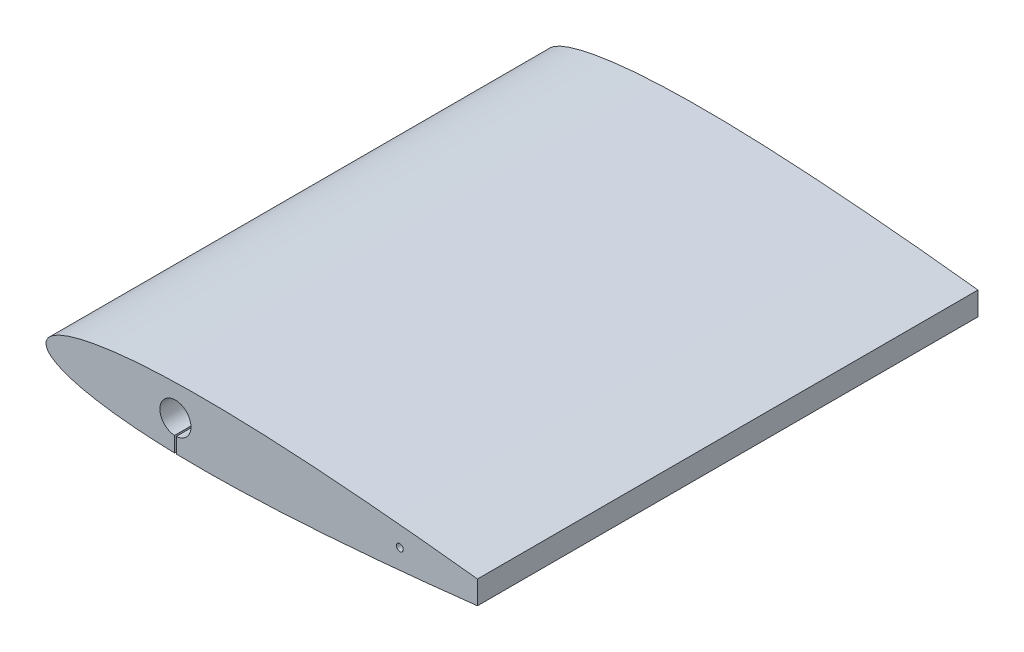
from build123d import *

# Parameters (mm, degrees)
BOSS_EXTRUDE1_DEPTH     = 290
SKETCH7_R               = 9
CUT_EXTRUDE7_DEPTH      = 418.641148142
SKETCH8_W               = 44.16
SKETCH8_H               = 34.63
CUT_EXTRUDE8_DEPTH      = 50
CUT_EXTRUDE9_DEPTH      = 50
CUT_EXTRUDE9_DEPTH_BACK = 50
SKETCH10_W              = 50
SKETCH10_H              = 290
SKETCH12_W              = 1
SKETCH12_H              = 290
CUT_EXTRUDE10_DEPTH     = 50
SKETCH13_R              = 2
CUT_EXTRUDE11_DEPTH     = 20
CUT_EXTRUDE12_START     = -20
SKETCH14_R              = 2
CUT_EXTRUDE12_DEPTH     = 20


with BuildPart() as part:
    # Sketch5 → Boss-Extrude1 (new body)
    with BuildSketch(Plane.XY):
        with BuildLine():
            Line((300, 0.378), (300, -0.378))
            add(Edge.make_bspline(
                [(300, 0.378), (299.270406424, 0.479445822), (297.234667094, 0.762503754), (293.659650161, 1.257673506), (289.112411795, 1.874242443), (284.080816659, 2.54451744), (278.752044218, 3.238122316), (273.265899022, 3.934946436), (267.705955472, 4.629019943), (262.11456302, 5.313069107), (256.508348909, 5.982191812), (250.891738994, 6.637990809), (245.269556965, 7.281779235), (239.647345349, 7.912232764), (234.025130107, 8.526992046), (228.399087903, 9.126229764), (222.768257645, 9.713077606), (217.135920793, 10.28745981), (211.505410154, 10.846941084), (205.877619803, 11.391642827), (200.251512374, 11.920884624), (194.626420536, 12.434617078), (189.002797137, 12.931911809), (183.381530938, 13.413097581), (177.763225616, 13.876376701), (172.148301533, 14.321237194), (166.537529462, 14.747820918), (160.931736194, 15.154228144), (155.33170885, 15.539100856), (149.737538345, 15.902649564), (144.148688279, 16.241846119), (138.565679604, 16.557420546), (132.990859803, 16.847397555), (127.42743944, 17.110211679), (121.877619637, 17.343891718), (116.340758577, 17.545256813), (110.815476382, 17.71267912), (105.301273398, 17.844497938), (99.800570116, 17.940091813), (94.317435844, 17.996590439), (88.855764067, 18.010124458), (83.418647975, 17.97923384), (78.008480827, 17.899160713), (72.628455365, 17.767033787), (67.282738746, 17.579413934), (61.977364895, 17.331515489), (56.720691016, 17.021032651), (51.525175322, 16.64095807), (46.408202619, 16.190188591), (41.394176065, 15.661669099), (36.515671087, 15.053963784), (31.819009441, 14.365623605), (27.366164829, 13.603475684), (23.235217954, 12.782583444), (19.502642451, 11.920250751), (16.218271393, 11.044597796), (13.389186016, 10.175076255), (10.984929333, 9.333498715), (8.961561478, 8.522062882), (7.267292053, 7.746976002), (5.846052466, 7.010625622), (4.647711085, 6.300634033), (3.628235251, 5.606513668), (2.751909197, 4.926635252), (2.00625736, 4.249917259), (1.390586137, 3.570259492), (0.901000435, 2.890942252), (0.529275535, 2.220219273), (0.260479537, 1.566458936), (0.085712654, 0.931035928), (-0.003509247, 0.308981015), (-0.003509247, -0.308981015), (0.085712654, -0.931035928), (0.260479537, -1.566458936), (0.529275535, -2.220219273), (0.901000435, -2.890942252), (1.390586137, -3.570259492), (2.00625736, -4.249917259), (2.751909197, -4.926635252), (3.628235251, -5.606513668), (4.647711085, -6.300634033), (5.846052466, -7.010625622), (7.267292053, -7.746975999), (8.961561475, -8.522062895), (10.984929344, -9.333498651), (13.389185965, -10.175076559), (16.21827163, -11.044596377), (19.502641361, -11.92025728), (23.235222799, -12.782554413), (27.366127559, -13.603596161), (31.819075008, -14.365113363), (36.515634637, -15.054106097), (41.394182204, -15.661628887), (46.408200924, -16.190199694), (51.525175786, -16.640955027), (56.720690889, -17.02103348), (61.977364929, -17.331515263), (67.282738736, -17.579413995), (72.628455367, -17.767033771), (78.008480826, -17.899160717), (83.418647975, -17.979233839), (88.855764067, -18.010124458), (94.317435844, -17.996590438), (99.800570116, -17.940091813), (105.301273398, -17.844497938), (110.815476382, -17.71267912), (116.340758577, -17.545256813), (121.877619637, -17.343891718), (127.42743944, -17.110211679), (132.990859803, -16.847397555), (138.565679604, -16.557420546), (144.148688279, -16.241846119), (149.737538345, -15.902649564), (155.33170885, -15.539100856), (160.931736194, -15.154228144), (166.537529462, -14.747820918), (172.148301533, -14.321237194), (177.763225616, -13.876376701), (183.381530938, -13.413097581), (189.002797137, -12.931911809), (194.626420536, -12.434617078), (200.251512374, -11.920884624), (205.877619803, -11.391642827), (211.505410154, -10.846941084), (217.135920793, -10.28745981), (222.768257645, -9.713077606), (228.399087903, -9.126229764), (234.025130107, -8.526992046), (239.647345349, -7.912232764), (245.269556965, -7.281779235), (250.891738994, -6.637990809), (256.508348909, -5.982191812), (262.11456302, -5.313069107), (267.705955472, -4.629019943), (273.265899022, -3.934946436), (278.752044218, -3.238122316), (284.080816659, -2.54451744), (289.112411795, -1.874242443), (293.659650161, -1.257673506), (297.234667094, -0.762503754), (299.270406424, -0.479445822), (300, -0.378)],
                knots=[0, 0, 0, 0, 0.003612221, 0.010078953, 0.017698618, 0.026115111, 0.034970966, 0.04405038, 0.05323433, 0.06244757, 0.071673993, 0.080921319, 0.090177538, 0.099424342, 0.108664441, 0.117912199, 0.127169502, 0.136426595, 0.145675426, 0.154916495, 0.164153237, 0.173386649, 0.182615736, 0.191838089, 0.201053134, 0.210260393, 0.219458942, 0.228646747, 0.237822316, 0.246985224, 0.256137384, 0.265279416, 0.27440695, 0.283512193, 0.292591781, 0.301646285, 0.310681793, 0.319699068, 0.32869452, 0.33766016, 0.346588583, 0.355477412, 0.364322937, 0.373121614, 0.381867635, 0.390553005, 0.399166026, 0.407689628, 0.416098119, 0.424354887, 0.432412429, 0.440204728, 0.447630505, 0.454563638, 0.460855379, 0.466413319, 0.47122861, 0.475365774, 0.47890126, 0.481915077, 0.484498872, 0.486747127, 0.488741252, 0.490543179, 0.492182104, 0.493672831, 0.495031908, 0.49627906, 0.497424737, 0.498490166, 0.499502758, 0.500497254, 0.501509846, 0.502575275, 0.503720952, 0.504968104, 0.506327181, 0.507817908, 0.509456832, 0.51125876, 0.513252884, 0.51550114, 0.518084934, 0.521098752, 0.524634237, 0.528771401, 0.533586692, 0.539144632, 0.545436374, 0.552369506, 0.5597952, 0.567587571, 0.575645113, 0.583901881, 0.592310372, 0.600833974, 0.609446995, 0.618132365, 0.626878386, 0.635677063, 0.644522588, 0.653411417, 0.66233984, 0.67130548, 0.680300932, 0.689318207, 0.698353715, 0.707408219, 0.716487807, 0.72559305, 0.734720584, 0.743862616, 0.753014776, 0.762177684, 0.771353253, 0.780541058, 0.789739607, 0.798946866, 0.808161911, 0.817384264, 0.826613351, 0.835846763, 0.845083505, 0.854324574, 0.863573405, 0.872830498, 0.882087801, 0.891335559, 0.900575658, 0.909822462, 0.919078681, 0.928326007, 0.93755243, 0.94676567, 0.95594962, 0.965029034, 0.973884889, 0.982301382, 0.989921047, 0.996387779, 1, 1, 1, 1], degree=3))
        make_face()
    extrude(amount=BOSS_EXTRUDE1_DEPTH)

    # Sketch7 → Cut-Extrude7 (cut, through all)
    with BuildSketch(Plane.XY.offset(290)):
        with Locations((75, 0)):
            Circle(SKETCH7_R)
    extrude(amount=-CUT_EXTRUDE7_DEPTH, mode=Mode.SUBTRACT)

    # Sketch8 → Cut-Extrude8 (cut)
    with BuildSketch(Plane(origin=(0, 0, 0), x_dir=(1, 0, 0), z_dir=(0, 1, 0))):
        with Locations((175.000068065, -145)):
            Rectangle(SKETCH8_W, SKETCH8_H)
    extrude(amount=-CUT_EXTRUDE8_DEPTH, mode=Mode.SUBTRACT)

    # Sketch10 → Cut-Extrude9 (cut, two sides: drawn at the far end of the back side and taken through both)
    with BuildSketch(Plane(origin=(0, 0, 0), x_dir=(1, 0, 0), z_dir=(0, 1, 0)).offset(-CUT_EXTRUDE9_DEPTH_BACK)):
        with Locations((275, -145)):
            Rectangle(SKETCH10_W, SKETCH10_H)
    extrude(amount=CUT_EXTRUDE9_DEPTH + CUT_EXTRUDE9_DEPTH_BACK, mode=Mode.SUBTRACT)

    # Sketch12 → Cut-Extrude10 (cut)
    with BuildSketch(Plane(origin=(0, 0, 0), x_dir=(1, 0, 0), z_dir=(0, 1, 0))):
        with Locations((75.000068065, -145)):
            Rectangle(SKETCH12_W, SKETCH12_H)
    extrude(amount=-CUT_EXTRUDE10_DEPTH, mode=Mode.SUBTRACT)

    # Sketch13 → Cut-Extrude11 (cut)
    with BuildSketch(Plane.XY):
        with Locations((205, 0)):
            Circle(SKETCH13_R)
    extrude(amount=CUT_EXTRUDE11_DEPTH, mode=Mode.SUBTRACT)

    # Sketch14 → Cut-Extrude12 (cut)
    with BuildSketch(Plane.XY.offset(290).offset(CUT_EXTRUDE12_START)):
        with Locations((205, 0)):
            Circle(SKETCH14_R)
    extrude(amount=CUT_EXTRUDE12_DEPTH, mode=Mode.SUBTRACT)


solid = part.part
